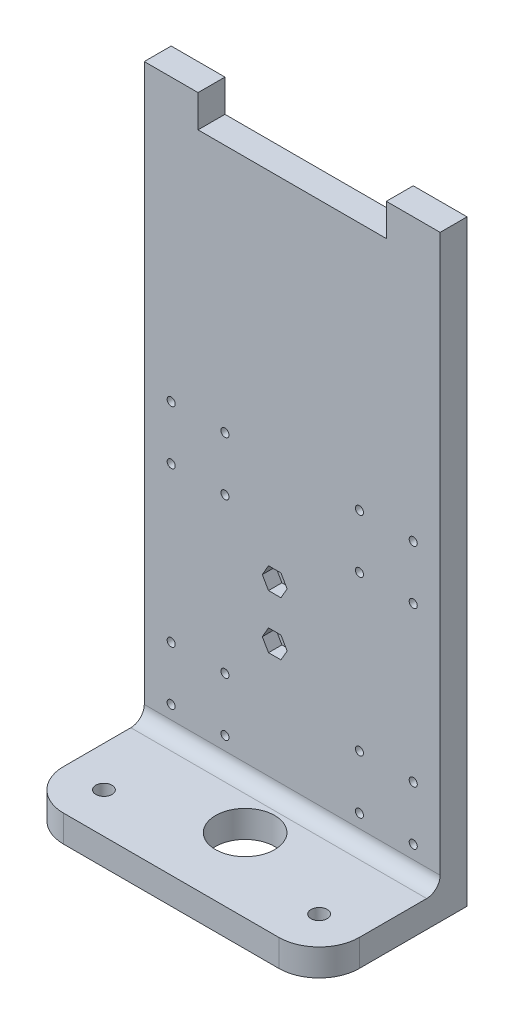
from build123d import *

# Parameters (mm, degrees)
SKETCH1_R           = 1.5
SKETCH1_R_2         = 2.5
BOSS_EXTRUDE1_DEPTH = 10
SKETCH4_W           = 110
SKETCH4_H           = 10
BOSS_EXTRUDE2_DEPTH = 55
SKETCH6_R           = 3
SKETCH6_R_2         = 11
CUT_EXTRUDE1_DEPTH  = 246.089779469
FILLET1_R           = 5
FILLET2_R           = 15
CUT_EXTRUDE2_DEPTH  = 5


with BuildPart() as part:
    # Sketch1 → Boss-Extrude1 (new body)
    with BuildSketch(Plane.XY):
        Polygon((20, 0), (90, 0), (110, 0), (110, 200), (110, 212), (90, 212), (90, 200), (20, 200), (20, 212), (0, 212), (0, 200), (0, 0), align=None)
        with Locations((100, 10)):
            Circle(SKETCH1_R, mode=Mode.SUBTRACT)
        with Locations((80, 10)):
            Circle(SKETCH1_R, mode=Mode.SUBTRACT)
        with Locations(Location((100, 30, 0), (0, 0, 180))):
            Circle(SKETCH1_R, mode=Mode.SUBTRACT)
        with Locations(Location((80, 30, 0), (0, 0, 180))):
            Circle(SKETCH1_R, mode=Mode.SUBTRACT)
        with Locations(Location((30, 10, 0), (0, 0, 180))):
            Circle(SKETCH1_R, mode=Mode.SUBTRACT)
        with Locations(Location((10, 10, 0), (0, 0, 180))):
            Circle(SKETCH1_R, mode=Mode.SUBTRACT)
        with Locations((10, 30)):
            Circle(SKETCH1_R, mode=Mode.SUBTRACT)
        with Locations((30, 30)):
            Circle(SKETCH1_R, mode=Mode.SUBTRACT)
        with Locations(Location((100, 107.5, 0), (0, 0, 180))):
            Circle(SKETCH1_R, mode=Mode.SUBTRACT)
        with Locations((100, 87.5)):
            Circle(SKETCH1_R, mode=Mode.SUBTRACT)
        with Locations((80, 87.5)):
            Circle(SKETCH1_R, mode=Mode.SUBTRACT)
        with Locations(Location((80, 107.5, 0), (0, 0, 180))):
            Circle(SKETCH1_R, mode=Mode.SUBTRACT)
        with Locations((30, 107.5)):
            Circle(SKETCH1_R, mode=Mode.SUBTRACT)
        with Locations((10, 107.5)):
            Circle(SKETCH1_R, mode=Mode.SUBTRACT)
        with Locations(Location((30, 87.5, 0), (0, 0, 180))):
            Circle(SKETCH1_R, mode=Mode.SUBTRACT)
        with Locations(Location((10, 87.5, 0), (0, 0, 180))):
            Circle(SKETCH1_R, mode=Mode.SUBTRACT)
        with Locations((48.5, 68.75)):
            Circle(SKETCH1_R_2, mode=Mode.SUBTRACT)
        with Locations((48.5, 48.75)):
            Circle(SKETCH1_R_2, mode=Mode.SUBTRACT)
    extrude(amount=BOSS_EXTRUDE1_DEPTH)

    # Sketch4 → Boss-Extrude2 (add)
    with BuildSketch(Plane(origin=(0, 0, 0), x_dir=(-1, 0, 0), z_dir=(0, 0, -1))):
        with Locations((-55, -5)):
            Rectangle(SKETCH4_W, SKETCH4_H)
    extrude(amount=-BOSS_EXTRUDE2_DEPTH)

    # Sketch6 → Cut-Extrude1 (cut, through all)
    with BuildSketch(Plane(origin=(0, 0, 0), x_dir=(1, 0, 0), z_dir=(0, 1, 0))):
        with Locations(Location((95, -40, 0), (0, 0, 180))):
            Circle(SKETCH6_R)
        with Locations(Location((15, -40, 0), (0, 0, 180))):
            Circle(SKETCH6_R)
        with Locations(Location((55, -27.5, 0), (0, 0, 180))):
            Circle(SKETCH6_R_2)
    extrude(amount=-CUT_EXTRUDE1_DEPTH, mode=Mode.SUBTRACT)

    # Fillet1
    fillet1_edges = [part.edges().sort_by_distance(p)[0] for p in [
        (55, 0, 10),
    ]]
    fillet(fillet1_edges, radius=FILLET1_R)

    # Fillet2
    fillet2_edges = [part.edges().sort_by_distance(p)[0] for p in [
        (0, -5, 55),
        (110, -5, 55),
    ]]
    fillet(fillet2_edges, radius=FILLET2_R)

    # Sketch7 → Cut-Extrude2 (cut)
    with BuildSketch(Plane.XY.offset(10)):
        Polygon((46.190598923, 72.75), (43.881197846, 68.75), (46.190598923, 64.75), (50.809401077, 64.75), (53.118802154, 68.75), (50.809401077, 72.75), align=None)
        Polygon((50.809401077, 52.75), (46.190598923, 52.75), (43.881197846, 48.75), (46.190598923, 44.75), (50.809401077, 44.75), (53.118802154, 48.75), align=None)
    extrude(amount=-CUT_EXTRUDE2_DEPTH, mode=Mode.SUBTRACT)


solid = part.part
